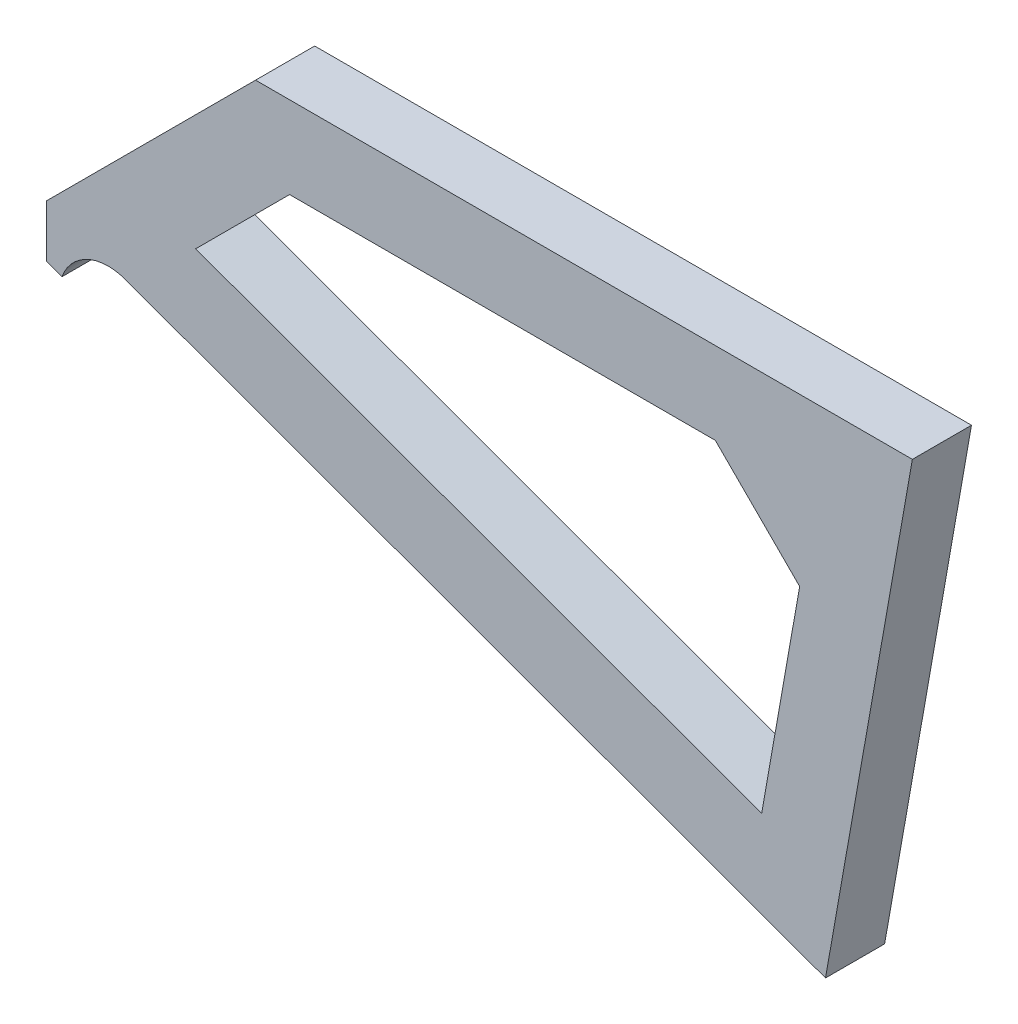
from build123d import *

# Parameters (mm, degrees)
BOSS_EXTRUDE2_DEPTH = 18


with BuildPart() as part:
    # Sketch5 → Boss-Extrude2 (new body)
    with BuildSketch(Plane.XY):
        with BuildLine():
            ThreePointArc((-239.737512556, -72.369347264), (-251.207088632, -72.87011977), (-258.963204018, -81.334434426))
            Line((-258.963204018, -81.334434426), (-263.661667122, -79.624333709))
            Line((-263.661667122, -79.624333709), (-263.661667122, -65.732734934))
            Line((-263.661667122, -65.732734934), (-263.661667122, -63.661667122))
            Line((-263.661667122, -63.661667122), (-262.197201028, -62.197201028))
            Line((-262.197201028, -62.197201028), (-201.464466094, -1.464466094))
            Line((-201.464466094, -1.464466094), (-200, 0))
            Line((-200, 0), (-197.928932188, 0))
            Line((-197.928932188, 0), (-5.958767963, 0))
            Line((-5.958767963, 0), (0, 0))
            Line((0, 0), (-1.034729198, -5.868240888))
            Line((-1.034729198, -5.868240888), (-25.414317908, -144.131759112))
            Line((-25.414317908, -144.131759112), (-26.449047106, -150))
            Line((-26.449047106, -150), (-32.04845739, -147.961981327))
            Line((-32.04845739, -147.961981327), (-239.737512556, -72.369347264))
        make_face()
        Polygon((-218.235614695, -53.590953754), (-45.895594942, -116.317591117), (-34.321629376, -50.678370624), (-60, -25), (-189.644660941, -25), align=None, mode=Mode.SUBTRACT)
    extrude(amount=BOSS_EXTRUDE2_DEPTH)


solid = part.part
